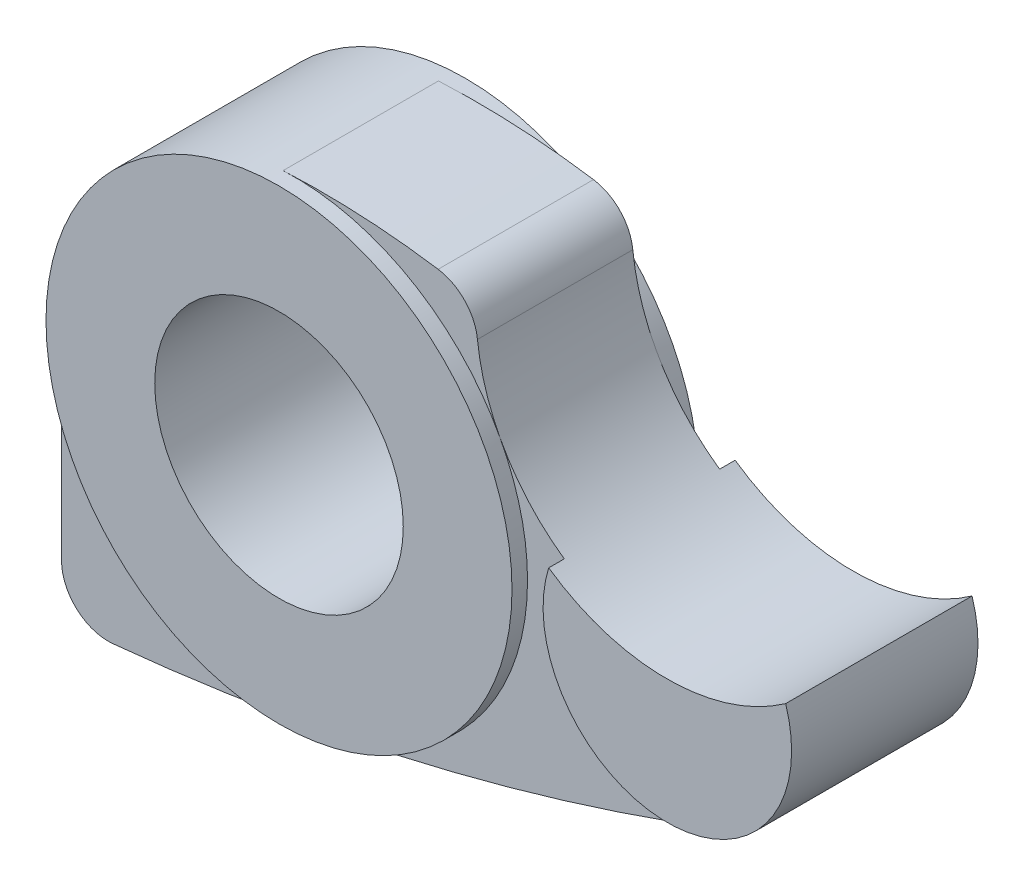
from build123d import *

# Parameters (mm, degrees)
EXTRUDE_1_DEPTH     = 5
EXTRUDE_2_DEPTH     = 6
EXTRUDE_3_DEPTH     = 6
SKETCH_4_R          = 8
CUT_EXTRUDE_1_DEPTH = 39.963875359


with BuildPart() as part:
    # 草图1 → 凸台-拉伸1 (new, symmetric)
    with BuildSketch(Plane.XY):
        with BuildLine():
            ThreePointArc((17.364205719, 2.386345678), (19.534538398, -5.841979928), (27.889014085, -7.460133888))
            ThreePointArc((27.889014085, -7.460133888), (32.219400839, -3.446774076), (32.617548437, 2.443963137))
            ThreePointArc((32.617548437, 2.443963137), (24.999999643, 9.4528e-05), (17.364205719, 2.386345678))
        make_face()
        with BuildLine():
            ThreePointArc((-0.737142857, 14.981876398), (-10.864095518, 10.342699288), (-15, 0))
            Line((-15, 0), (-15, -13.8873794))
            ThreePointArc((-15, -13.8873794), (-14.015653031, -16.10934764), (-11.708571429, -16.873190745))
            ThreePointArc((-11.708571429, -16.873190745), (8.410971794, -13.51595237), (27.889014085, -7.460133888))
            ThreePointArc((27.889014085, -7.460133888), (19.534538398, -5.841979928), (17.364205719, 2.386345678))
            ThreePointArc((17.364205719, 2.386345678), (13.547023493, 6.501980338), (11.776397664, 11.828725402))
            ThreePointArc((11.776397664, 11.828725402), (10.960769899, 13.5814964), (9.245219778, 14.472755399))
            ThreePointArc((9.245219778, 14.472755399), (4.266792486, 14.97738476), (-0.737142857, 14.981876398))
        make_face()
    extrude(amount=EXTRUDE_1_DEPTH, both=True)

    # 草图2 → 凸台-拉伸2 (add, symmetric)
    with BuildSketch(Plane.XY):
        with BuildLine():
            ThreePointArc((-15, 0), (3.625161022, -14.555349792), (13.247761009, 7.03539823))
            ThreePointArc((13.247761009, 7.03539823), (7.410500688, 13.041644051), (-0.737142857, 14.981876398))
            ThreePointArc((-0.737142857, 14.981876398), (-10.864095518, 10.342699288), (-15, 0))
        make_face()
    extrude(amount=EXTRUDE_2_DEPTH, both=True)

    # 草图3 → 凸台-拉伸3 (add, symmetric)
    with BuildSketch(Plane.XY):
        with BuildLine():
            ThreePointArc((17.364205719, 2.386345678), (25.030218713, -7.999942927), (32.617548437, 2.443963137))
            ThreePointArc((32.617548437, 2.443963137), (24.999999643, 9.4528e-05), (17.364205719, 2.386345678))
        make_face()
    extrude(amount=EXTRUDE_3_DEPTH, both=True)

    # 草图4 → 切除-拉伸1 (cut, through all)
    with BuildSketch(Plane.XY.offset(6)):
        Circle(SKETCH_4_R)
    extrude(amount=-CUT_EXTRUDE_1_DEPTH, mode=Mode.SUBTRACT)


solid = part.part
